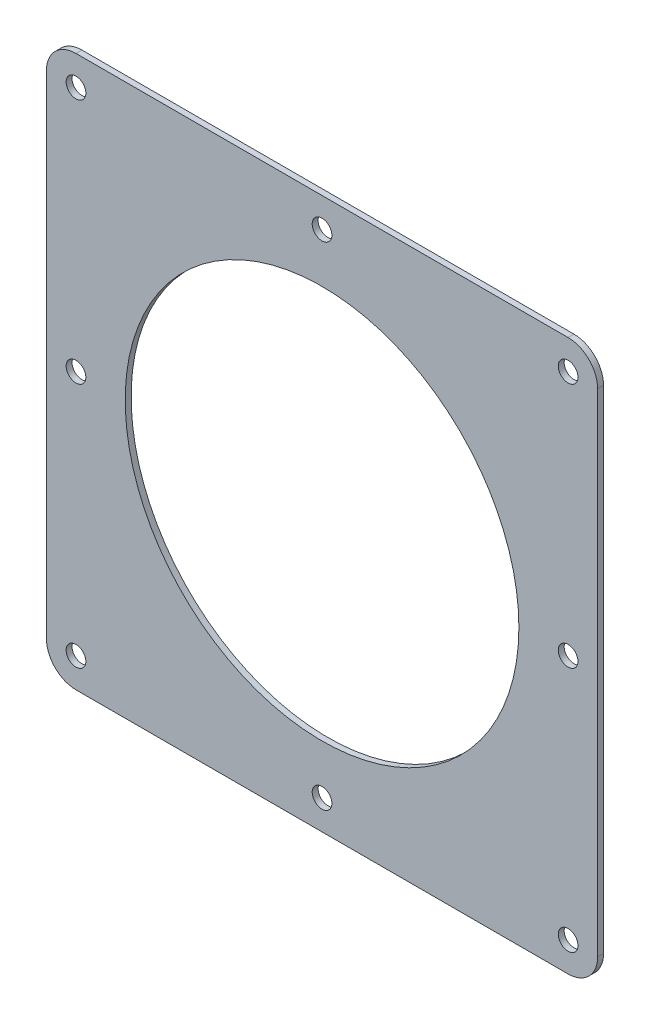
from build123d import *

# Parameters (mm, degrees)
SKETCH2_R           = 5
SKETCH2_R_2         = 4
BOSS_EXTRUDE1_DEPTH = 3
SKETCH7_R           = 100
CUT_EXTRUDE2_DEPTH  = 10


with BuildPart() as part:
    # Sketch2 → Boss-Extrude1 (new body)
    with BuildSketch(Plane.XY):
        with BuildLine():
            Line((-125, 140), (125, 140))
            ThreePointArc((125, 140), (135.606601718, 135.606601718), (140, 125))
            Line((140, 125), (140, -125))
            ThreePointArc((140, -125), (135.606601718, -135.606601718), (125, -140))
            Line((125, -140), (-125, -140))
            ThreePointArc((-125, -140), (-135.606601718, -135.606601718), (-140, -125))
            Line((-140, -125), (-140, 125))
            ThreePointArc((-140, 125), (-135.606601718, 135.606601718), (-125, 140))
        make_face()
        with Locations((-125, 125)):
            Circle(SKETCH2_R, mode=Mode.SUBTRACT)
        with Locations((0, 125)):
            Circle(SKETCH2_R, mode=Mode.SUBTRACT)
        with Locations((125, 125)):
            Circle(SKETCH2_R, mode=Mode.SUBTRACT)
        Circle(SKETCH2_R_2, mode=Mode.SUBTRACT)
        with Locations((125, 0)):
            Circle(SKETCH2_R, mode=Mode.SUBTRACT)
        with Locations((-125, 0)):
            Circle(SKETCH2_R, mode=Mode.SUBTRACT)
        with Locations((-125, -125)):
            Circle(SKETCH2_R, mode=Mode.SUBTRACT)
        with Locations((0, -125)):
            Circle(SKETCH2_R, mode=Mode.SUBTRACT)
        with Locations((125, -125)):
            Circle(SKETCH2_R, mode=Mode.SUBTRACT)
    extrude(amount=BOSS_EXTRUDE1_DEPTH)

    # Sketch7 → Cut-Extrude2 (cut)
    with BuildSketch(Plane.XY.offset(3)):
        Circle(SKETCH7_R)
    extrude(amount=-CUT_EXTRUDE2_DEPTH, mode=Mode.SUBTRACT)


solid = part.part
